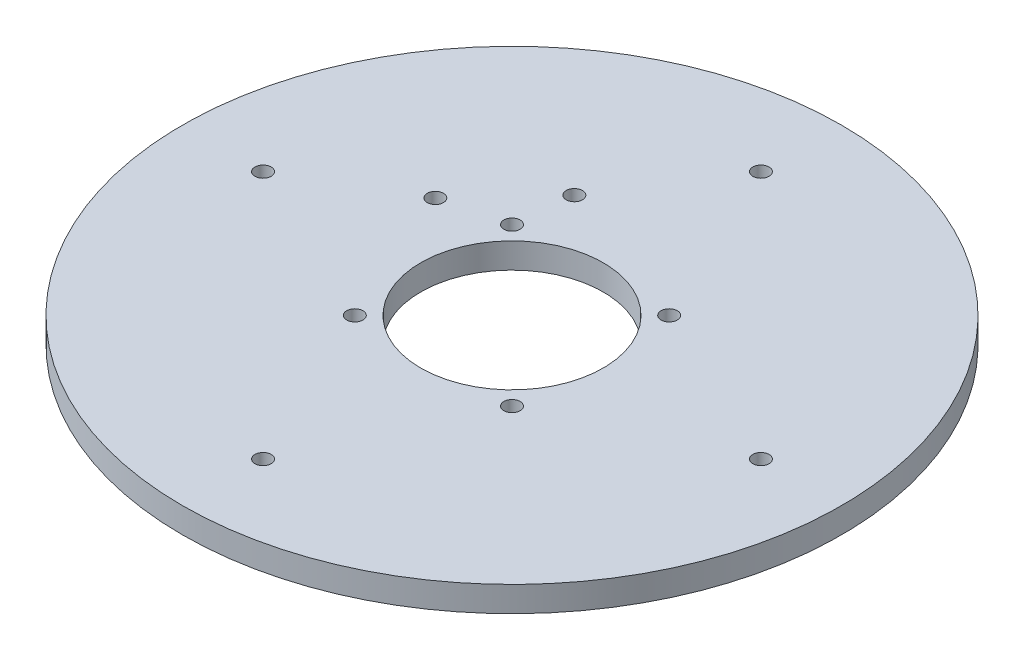
from build123d import *

# Parameters (mm, degrees)
SKETCH_2_W          = 46
SKETCH_2_H          = 46
SKETCH_2_R          = 18
EXTRUDE_1_DEPTH     = 5
FILLET_1_R          = 5.5
SKETCH_3_R          = 1.6
CUT_EXTRUDE_1_DEPTH = 33.908965344
SKETCH_4_R          = 65
SKETCH_4_R_2        = 1.6
SKETCH_4_R_3        = 18
EXTRUDE_2_DEPTH     = 5
SKETCH_7_R          = 1.6
CUT_EXTRUDE_3_DEPTH = 93.059763198


with BuildPart() as part:
    # 草图2 → 凸台-拉伸1 (new body)
    with BuildSketch(Plane(origin=(0, 0, 0), x_dir=(1, 0, 0), z_dir=(0, 1, 0))):
        Rectangle(SKETCH_2_W, SKETCH_2_H)
        with Locations(Location((0, 0, 0), (0, 0, 270))):
            Circle(SKETCH_2_R, mode=Mode.SUBTRACT)
    extrude(amount=EXTRUDE_1_DEPTH)

    # 圆角1
    fillet_1_edges = [part.edges().sort_by_distance(p)[0] for p in [
        (23, 2.5, 23),
        (-23, 2.5, 23),
        (-23, 2.5, -23),
        (23, 2.5, -23),
    ]]
    fillet(fillet_1_edges, radius=FILLET_1_R)

    # 草图3 → 切除-拉伸1 (cut, through all)
    with BuildSketch(Plane(origin=(0, 5, 0), x_dir=(1, 0, 0), z_dir=(0, 1, 0))):
        with Locations(Location((-15.5, 15.5, 0), (0, 0, 270))):
            Circle(SKETCH_3_R)
        with Locations(Location((15.5, 15.5, 0), (0, 0, 270))):
            Circle(SKETCH_3_R)
        with Locations(Location((-15.5, -15.5, 0), (0, 0, 270))):
            Circle(SKETCH_3_R)
        with Locations(Location((15.5, -15.5, 0), (0, 0, 270))):
            Circle(SKETCH_3_R)
    extrude(amount=-CUT_EXTRUDE_1_DEPTH, mode=Mode.SUBTRACT)

    # 草图4 → 凸台-拉伸2 (add)
    # profile 1 of 2: a face of its own
    with BuildSketch(Plane(origin=(0, 5, 0), x_dir=(1, 0, 0), z_dir=(0, 1, 0))):
        with Locations(Location((0, 0, 0), (0, 0, 270))):
            Circle(SKETCH_4_R)
        with Locations(Location((-49.1, 0, 0), (0, 0, 270))):
            Circle(SKETCH_4_R_2, mode=Mode.SUBTRACT)
        with Locations(Location((0, -49.1, 0), (0, 0, 270))):
            Circle(SKETCH_4_R_2, mode=Mode.SUBTRACT)
        with Locations(Location((49.1, 0, 0), (0, 0, 270))):
            Circle(SKETCH_4_R_2, mode=Mode.SUBTRACT)
        with Locations(Location((0, 49.1, 0), (0, 0, 270))):
            Circle(SKETCH_4_R_2, mode=Mode.SUBTRACT)
        with BuildLine():
            Line((-17.5, -23), (17.5, -23))
            ThreePointArc((17.5, -23), (21.389087297, -21.389087297), (23, -17.5))
            Line((23, -17.5), (23, 17.5))
            ThreePointArc((23, 17.5), (21.389087297, 21.389087297), (17.5, 23))
            Line((17.5, 23), (-17.5, 23))
            ThreePointArc((-17.5, 23), (-21.389087297, 21.389087297), (-23, 17.5))
            Line((-23, 17.5), (-23, -17.5))
            ThreePointArc((-23, -17.5), (-21.389087297, -21.389087297), (-17.5, -23))
        make_face(mode=Mode.SUBTRACT)
    # profile 2 of 2: a face of its own
    with BuildSketch(Plane(origin=(0, 5, 0), x_dir=(1, 0, 0), z_dir=(0, 1, 0))):
        with BuildLine():
            ThreePointArc((-23, -17.5), (-21.389087297, -21.389087297), (-17.5, -23))
            Line((-17.5, -23), (17.5, -23))
            ThreePointArc((17.5, -23), (21.389087297, -21.389087297), (23, -17.5))
            Line((23, -17.5), (23, 17.5))
            ThreePointArc((23, 17.5), (21.389087297, 21.389087297), (17.5, 23))
            Line((17.5, 23), (-17.5, 23))
            ThreePointArc((-17.5, 23), (-21.389087297, 21.389087297), (-23, 17.5))
            Line((-23, 17.5), (-23, -17.5))
        make_face()
        with Locations(Location((15.5, 15.5, 0), (0, 0, 270))):
            Circle(SKETCH_4_R_2, mode=Mode.SUBTRACT)
        with Locations(Location((-15.5, -15.5, 0), (0, 0, 270))):
            Circle(SKETCH_4_R_2, mode=Mode.SUBTRACT)
        with Locations(Location((0, 0, 0), (0, 0, 270))):
            Circle(SKETCH_4_R_3, mode=Mode.SUBTRACT)
        with Locations(Location((-15.5, 15.5, 0), (0, 0, 270))):
            Circle(SKETCH_4_R_2, mode=Mode.SUBTRACT)
        with Locations(Location((15.5, -15.5, 0), (0, 0, 270))):
            Circle(SKETCH_4_R_2, mode=Mode.SUBTRACT)
    extrude(amount=-EXTRUDE_2_DEPTH)

    # 草图7 → 切除-拉伸3 (cut, through all)
    with BuildSketch(Plane(origin=(0, 5, 0), x_dir=(1, 0, 0), z_dir=(0, 1, 0))):
        with Locations(Location((-14.383356955, 26.682742705, 0), (0, 0, 270))):
            Circle(SKETCH_7_R)
        with Locations(Location((-27.616643045, 12.496829297, 0), (0, 0, 270))):
            Circle(SKETCH_7_R)
    extrude(amount=-CUT_EXTRUDE_3_DEPTH, mode=Mode.SUBTRACT)


solid = part.part
